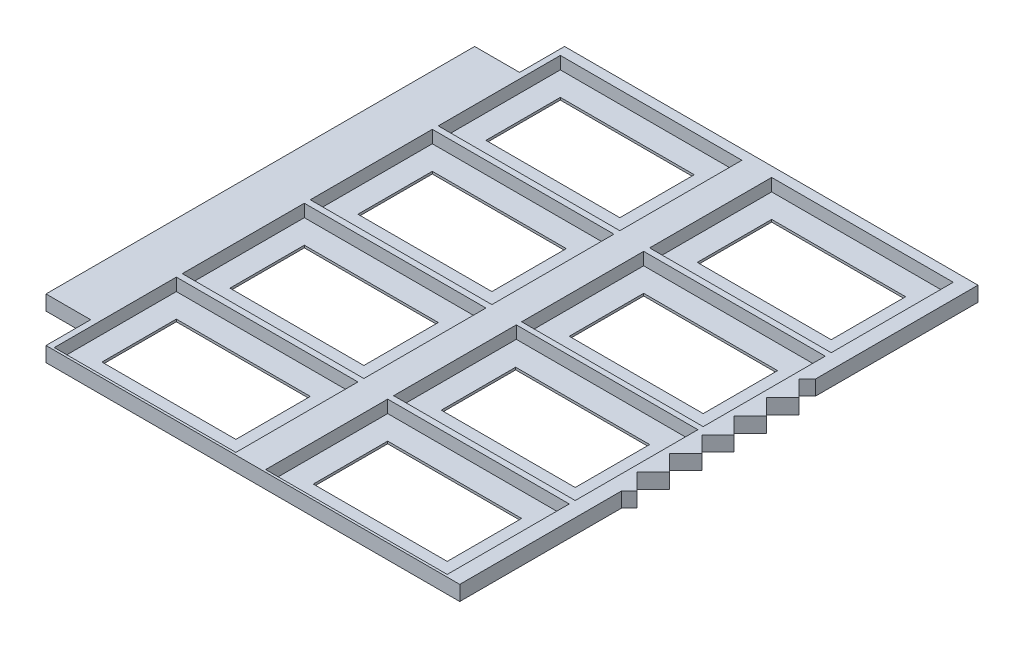
from build123d import *

# Parameters (mm, degrees)
SKETCH1_W           = 77.47
SKETCH1_H           = 52.07
SKETCH1_R           = 1.5875
SKETCH1_H_2         = 52.34
BOSS_EXTRUDE3_DEPTH = 6.35
SKETCH2_W           = 19.05
SKETCH2_H           = 1
CUT_EXTRUDE1_DEPTH  = 193.995155978
SKETCH4_W           = 19.05
SKETCH4_H           = 1
CUT_EXTRUDE2_DEPTH  = 193.995155978
SKETCH5_W           = 257.81
SKETCH5_H           = 1
BOSS_EXTRUDE4_DEPTH = 215.9
SKETCH6_W           = 57.15
SKETCH6_H           = 31.75
CUT_EXTRUDE3_DEPTH  = 193.964841955
CUT_EXTRUDE4_DEPTH  = 193.995155978


with BuildPart() as part:
    # Sketch1 → Boss-Extrude3 (new body)
    with BuildSketch(Plane(origin=(0, 0, 0), x_dir=(1, 0, 0), z_dir=(0, 1, 0))):
        Polygon((148.59, 94.11025641), (129.54, 94.11025641), (129.54, 113.16025641), (-137.02974359, 113.16025641), (-137.02974359, 93.98), (-156.21, 93.98), (-156.21, -88.9), (-137.16, -88.9), (-137.16, -106.95), (-156.21, -106.95), (-156.21, -107.95), (148.59, -107.95), (148.59, -106.95), (129.54, -106.95), (129.54, -88.9), (148.59, -88.9), align=None)
        with Locations((-95.885, -80.915)):
            Rectangle(SKETCH1_W, SKETCH1_H, mode=Mode.SUBTRACT)
        with Locations((-5.715, -80.915)):
            Rectangle(SKETCH1_W, SKETCH1_H, mode=Mode.SUBTRACT)
        with Locations((84.455, -80.915)):
            Rectangle(SKETCH1_W, SKETCH1_H, mode=Mode.SUBTRACT)
        with Locations((84.455, 82.915)):
            Rectangle(SKETCH1_W, SKETCH1_H, mode=Mode.SUBTRACT)
        with Locations((84.455, 28.305)):
            Rectangle(SKETCH1_W, SKETCH1_H, mode=Mode.SUBTRACT)
        with Locations((84.455, -26.305)):
            Rectangle(SKETCH1_W, SKETCH1_H, mode=Mode.SUBTRACT)
        with Locations(Location((139.065, 75.334869264, 0), (0, 0, 270))):
            Circle(SKETCH1_R, mode=Mode.SUBTRACT)
        with Locations(Location((139.065, 80.910552749, 0), (0, 0, 270))):
            Circle(SKETCH1_R, mode=Mode.SUBTRACT)
        with Locations(Location((139.065, 86.618990604, 0), (0, 0, 270))):
            Circle(SKETCH1_R, mode=Mode.SUBTRACT)
        with Locations((-5.715, 82.915)):
            Rectangle(SKETCH1_W, SKETCH1_H, mode=Mode.SUBTRACT)
        with Locations((-95.885, -26.305)):
            Rectangle(SKETCH1_W, SKETCH1_H, mode=Mode.SUBTRACT)
        with Locations((-5.715, -26.17)):
            Rectangle(SKETCH1_W, SKETCH1_H_2, mode=Mode.SUBTRACT)
        with Locations((-95.885, 28.305)):
            Rectangle(SKETCH1_W, SKETCH1_H, mode=Mode.SUBTRACT)
        with Locations((-5.715, 28.305)):
            Rectangle(SKETCH1_W, SKETCH1_H, mode=Mode.SUBTRACT)
        with Locations((-95.885, 82.915)):
            Rectangle(SKETCH1_W, SKETCH1_H, mode=Mode.SUBTRACT)
    extrude(amount=BOSS_EXTRUDE3_DEPTH)

    # Sketch2 → Cut-Extrude1 (cut, through all)
    with BuildSketch(Plane(origin=(0, 6.35, 0), x_dir=(1, 0, 0), z_dir=(0, 1, 0))):
        with Locations((139.065, -107.45)):
            Rectangle(SKETCH2_W, SKETCH2_H)
    extrude(amount=-CUT_EXTRUDE1_DEPTH, mode=Mode.SUBTRACT)

    # Sketch4 → Cut-Extrude2 (cut, through all)
    with BuildSketch(Plane(origin=(0, 6.35, 0), x_dir=(1, 0, 0), z_dir=(0, 1, 0))):
        with Locations((-146.685, -107.45)):
            Rectangle(SKETCH4_W, SKETCH4_H)
    extrude(amount=-CUT_EXTRUDE2_DEPTH, mode=Mode.SUBTRACT)

    # Sketch5 → Boss-Extrude4 (add)
    with BuildSketch(Plane.XY.offset(-108.95)):
        with Locations((-5.715, 0.5)):
            Rectangle(SKETCH5_W, SKETCH5_H)
    extrude(amount=BOSS_EXTRUDE4_DEPTH)

    # Sketch6 → Cut-Extrude3 (cut, through all)
    with BuildSketch(Plane(origin=(0, 1, 0), x_dir=(1, 0, 0), z_dir=(0, 1, 0))):
        with Locations((-95.885, 82.915)):
            Rectangle(SKETCH6_W, SKETCH6_H)
        with Locations((-95.885, 28.305)):
            Rectangle(SKETCH6_W, SKETCH6_H)
        with Locations((-95.885, -26.305)):
            Rectangle(SKETCH6_W, SKETCH6_H)
        with Locations((-95.885, -80.915)):
            Rectangle(SKETCH6_W, SKETCH6_H)
        with Locations((-5.715, 82.915)):
            Rectangle(SKETCH6_W, SKETCH6_H)
        with Locations((84.455, 82.915)):
            Rectangle(SKETCH6_W, SKETCH6_H)
        with Locations((-5.715, 28.305)):
            Rectangle(SKETCH6_W, SKETCH6_H)
        with Locations((-5.715, -26.305)):
            Rectangle(SKETCH6_W, SKETCH6_H)
        with Locations((-5.715, -80.915)):
            Rectangle(SKETCH6_W, SKETCH6_H)
        with Locations((84.455, -80.915)):
            Rectangle(SKETCH6_W, SKETCH6_H)
        with Locations((84.455, -26.305)):
            Rectangle(SKETCH6_W, SKETCH6_H)
        with Locations((84.455, 28.305)):
            Rectangle(SKETCH6_W, SKETCH6_H)
    extrude(amount=-CUT_EXTRUDE3_DEPTH, mode=Mode.SUBTRACT)

    # Sketch7 → Cut-Extrude4 (cut, through all)
    with BuildSketch(Plane(origin=(0, 6.35, 0), x_dir=(1, 0, 0), z_dir=(0, 1, 0))):
        Polygon((39.37, 43.846772262), (35.788770068, 40.26554233), (42.679389728, 33.37492267), (35.788770068, 26.48430301), (42.679389728, 19.593683351), (39.37, 16.284293623), (35.788770068, 12.703063691), (42.679389728, 5.812444031), (35.788770068, -1.078175628), (42.679389728, -7.968795288), (35.788770068, -14.859414948), (39.37, -18.44064488), (42.679389728, -21.750034608), (35.788770068, -28.640654267), (42.679389728, -35.531273927), (39.37, -38.840663655), (39.37, -107.95), (150.027202107, -107.95), (150.027202107, 113.16025641), (39.37, 113.16025641), align=None)
    extrude(amount=-CUT_EXTRUDE4_DEPTH, mode=Mode.SUBTRACT)


solid = part.part
